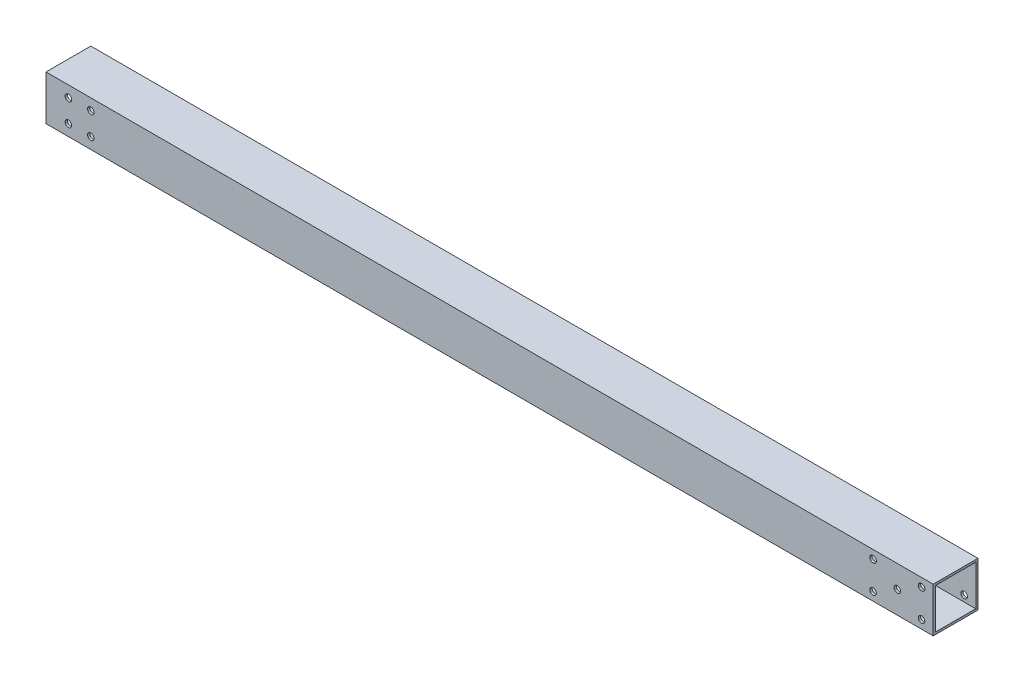
from build123d import *

# Parameters (mm, degrees)
SKETCH_1_W          = 20
SKETCH_1_H          = 20
SKETCH_1_W_2        = 18
SKETCH_1_H_2        = 18
EXTRUDE_1_DEPTH     = 396
SKETCH_2_R          = 1.45
CUT_EXTRUDE_1_DEPTH = 397.630810704
SKETCH_3_R          = 1.45
CUT_EXTRUDE_2_DEPTH = 397.630810704


with BuildPart() as part:
    # 草图1 → 凸台-拉伸1 (new body)
    with BuildSketch(Plane(origin=(0, 0, 0), x_dir=(0, 0, -1), z_dir=(1, 0, 0))):
        Rectangle(SKETCH_1_W, SKETCH_1_H)
        Rectangle(SKETCH_1_W_2, SKETCH_1_H_2, mode=Mode.SUBTRACT)
    extrude(amount=EXTRUDE_1_DEPTH)

    # 草图2 → 切除-拉伸1 (cut, through all)
    with BuildSketch(Plane(origin=(0, 0, -10), x_dir=(-1, 0, 0), z_dir=(0, 0, -1))):
        with Locations((-380, -12.5)):
            Circle(SKETCH_2_R)
        with Locations(Location((-390.825317547, -6.25, 0), (0, 0, 90))):
            Circle(SKETCH_2_R)
        with Locations(Location((-390.825317547, 6.25, 0), (0, 0, 90))):
            Circle(SKETCH_2_R)
        with Locations((-380, 12.5)):
            Circle(SKETCH_2_R)
        with Locations(Location((-369.174682453, 6.25, 0), (0, 0, 90))):
            Circle(SKETCH_2_R)
        with Locations(Location((-369.174682453, -6.25, 0), (0, 0, 90))):
            Circle(SKETCH_2_R)
        with Locations(Location((-380, 0, 0), (0, 0, 90))):
            Circle(SKETCH_2_R)
    extrude(amount=-CUT_EXTRUDE_1_DEPTH, mode=Mode.SUBTRACT)

    # 草图3 → 切除-拉伸2 (cut, through all)
    with BuildSketch(Plane.XY.offset(10)):
        with Locations((10, 5)):
            Circle(SKETCH_3_R)
        with Locations((20, 5)):
            Circle(SKETCH_3_R)
        with Locations((10, -5)):
            Circle(SKETCH_3_R)
        with Locations((20, -5)):
            Circle(SKETCH_3_R)
        with Locations(Location((369.174682453, 6.25, 0), (0, 0, 90))):
            Circle(SKETCH_3_R)
        with Locations(Location((380, 0, 0), (0, 0, 90))):
            Circle(SKETCH_3_R)
        with Locations(Location((369.174682453, -6.25, 0), (0, 0, 90))):
            Circle(SKETCH_3_R)
        with Locations(Location((390.825317547, -6.25, 0), (0, 0, 90))):
            Circle(SKETCH_3_R)
        with Locations(Location((390.825317547, 6.25, 0), (0, 0, 90))):
            Circle(SKETCH_3_R)
    extrude(amount=-CUT_EXTRUDE_2_DEPTH, mode=Mode.SUBTRACT)


solid = part.part
